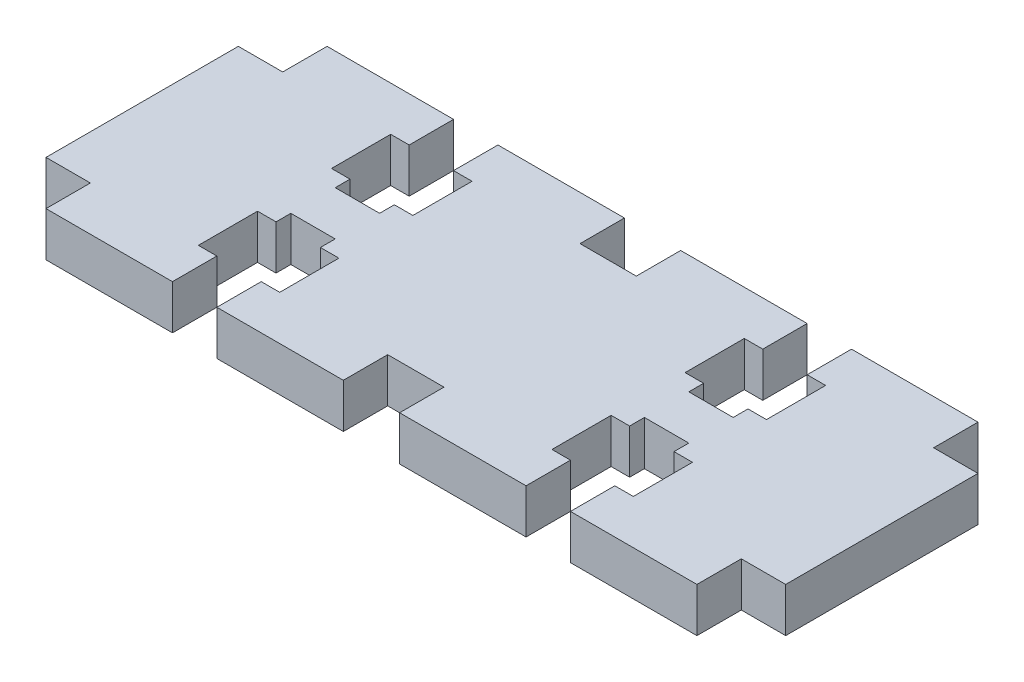
from build123d import *

# Parameters (mm, degrees)
EXTRUDE_1_DEPTH = 3


with BuildPart() as part:
    # 草图1 → 凸台-拉伸1 (new body)
    with BuildSketch(Plane(origin=(0, 0, 0), x_dir=(1, 0, 0), z_dir=(0, 1, 0))):
        Polygon((15.799055804, 0), (15.799055804, -4), (14.549055804, -4), (14.549055804, -5), (11.549055804, -5), (11.549055804, -4), (10.299055804, -4), (10.299055804, 0), (11.549055804, 0), (11.549055804, 3), (3, 3), (3, 0), (0, 0), (0, -13), (3, -13), (3, -16), (11.549055804, -16), (11.549055804, -13), (10.299055804, -13), (10.299055804, -9), (11.549055804, -9), (11.549055804, -8), (14.549055804, -8), (14.549055804, -9), (15.799055804, -9), (15.799055804, -13), (14.549055804, -13), (14.549055804, -16), (23.098111609, -16), (23.098111609, -13), (26.901888391, -13), (26.901888391, -16), (35.450944196, -16), (35.450944196, -13), (34.200944196, -13), (34.200944196, -9), (35.450944196, -9), (35.450944196, -8), (38.450944196, -8), (38.450944196, -9), (39.700944196, -9), (39.700944196, -13), (38.450944196, -13), (38.450944196, -16), (47, -16), (47, -13), (50, -13), (50, 0), (47, 0), (47, 3), (38.450944196, 3), (38.450944196, 0), (39.700944196, 0), (39.700944196, -4), (38.450944196, -4), (38.450944196, -5), (35.450944196, -5), (35.450944196, -4), (34.200944196, -4), (34.200944196, 0), (35.450944196, 0), (35.450944196, 3), (26.901888391, 3), (26.901888391, 0), (23.098111609, 0), (23.098111609, 3), (14.549055804, 3), (14.549055804, 0), align=None)
    extrude(amount=EXTRUDE_1_DEPTH)


solid = part.part
